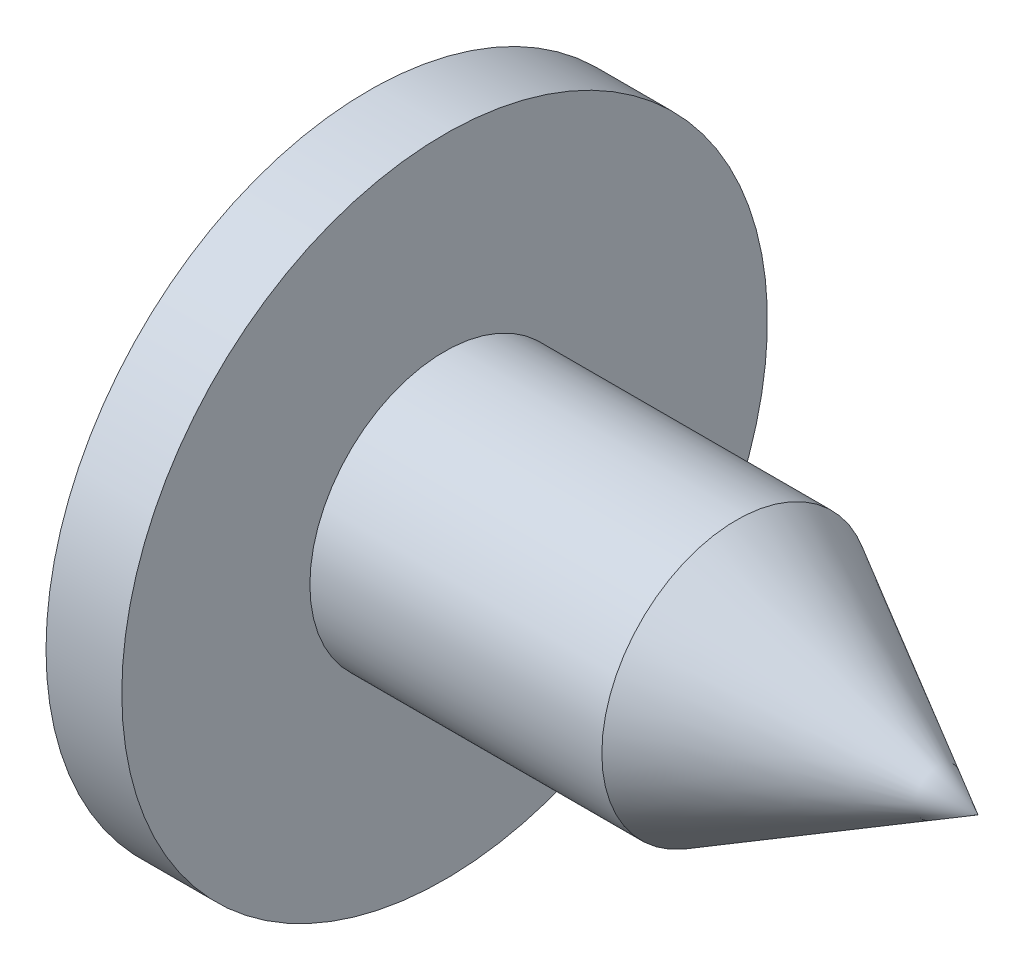
from build123d import *

# Parameters (mm, degrees)
CHAMFER1_SIZE      = 0.48
CHAMFER1_SIZE2     = 0.831384388
CUT_EXTRUDE1_DEPTH = 2.28
DRAFT1_ANGLE       = -35
DRAFT2_ANGLE       = -8
FILLET1_R          = 0.416666667


with BuildPart() as part:
    # Sketch1 → Revolve1 (revolve)
    with BuildSketch(Plane.XY, mode=Mode.PRIVATE) as revolve1_sk:
        with BuildLine():
            Line((0, 5.75), (0, 2.4))
            Line((0, 2.4), (9.5, 2.4))
            Line((9.5, 2.4), (9.5, 0))
            Line((9.5, 0), (-3.55, 0))
            ThreePointArc((-3.55, 0), (-2.974948133, 2.694438717), (-1.35, 4.91934955))
            Line((-1.35, 4.91934955), (-1.35, 5.75))
            Line((-1.35, 5.75), (0, 5.75))
        make_face()
    revolve(revolve1_sk.sketch.rotate(Axis((-6.478309986, 0, 0), (1, 0, 0)), 90), axis=Axis((-6.478309986, 0, 0), (1, 0, 0)))

    # Chamfer1
    chamfer1_edges = [part.edges().sort_by_distance(p)[0] for p in [
        (9.5, 0, -2.4),
    ]]
    chamfer1_side = [part.faces().sort_by_distance(p)[0] for p in [
        (9.5, 0, 0),
    ]]
    chamfer(chamfer1_edges, length=CHAMFER1_SIZE, length2=CHAMFER1_SIZE2, reference=chamfer1_side[0])

    # Sketch8 → EndCone (revolve, cut)
    with BuildSketch(Plane.XY, mode=Mode.PRIVATE) as endcone_sk:
        Polygon((9.5, 0), (9.7, 0), (9.7, -2.6), (5.2, -2.6), (5.2, -2.4), align=None)
    revolve(endcone_sk.sketch.rotate(Axis((0, 0, 0), (1, 0, 0)), 270), axis=Axis((0, 0, 0), (1, 0, 0)), mode=Mode.SUBTRACT)

    # Sketch4 → Cut-Extrude1 (cut)
    with BuildSketch(Plane(origin=(-3.55, 0, 0), x_dir=(0, 0, -1), z_dir=(1, 0, 0))):
        Polygon((0.5, 2.5), (-0.5, 2.5), (-0.5, 0.5), (-2.5, 0.5), (-2.5, -0.5), (-0.5, -0.5), (-0.5, -2.5), (0.5, -2.5), (0.5, -0.5), (2.5, -0.5), (2.5, 0.5), (0.5, 0.5), align=None)
    extrude(amount=CUT_EXTRUDE1_DEPTH, mode=Mode.SUBTRACT)

    # Draft1
    draft1_faces = [part.faces().sort_by_distance(p)[0] for p in [
        (-2.160691933, 0, -2.5),
        (-2.160691933, -2.5, 0),
        (-2.160691933, 0, 2.5),
        (-2.160691933, 2.5, 0),
    ]]
    draft(draft1_faces, Plane.YZ.offset(-3.55), DRAFT1_ANGLE)

    # Draft2
    draft2_faces = [part.faces().sort_by_distance(p)[0] for p in [
        (-2.544118115, 1.102349446, -0.5),
        (-2.544118115, 0.5, -1.102349446),
        (-2.544118115, -0.5, -1.102349446),
        (-2.544118115, -1.102349446, -0.5),
        (-2.544118115, -1.102349446, 0.5),
        (-2.544118115, -0.5, 1.102349446),
        (-2.544118115, 0.5, 1.102349446),
        (-2.544118115, 1.102349446, 0.5),
    ]]
    draft(draft2_faces, Plane.YZ.offset(-3.55), DRAFT2_ANGLE)

    # Fillet1
    fillet1_edges = [part.edges().sort_by_distance(p)[0] for p in [
        (-2.391402154, 0.337169692, -0.337169692),
        (-2.391402154, 0.337169692, 0.337169692),
        (-2.391402154, -0.337169692, 0.337169692),
        (-2.391402154, -0.337169692, -0.337169692),
    ]]
    fillet(fillet1_edges, radius=FILLET1_R)


solid = part.part
